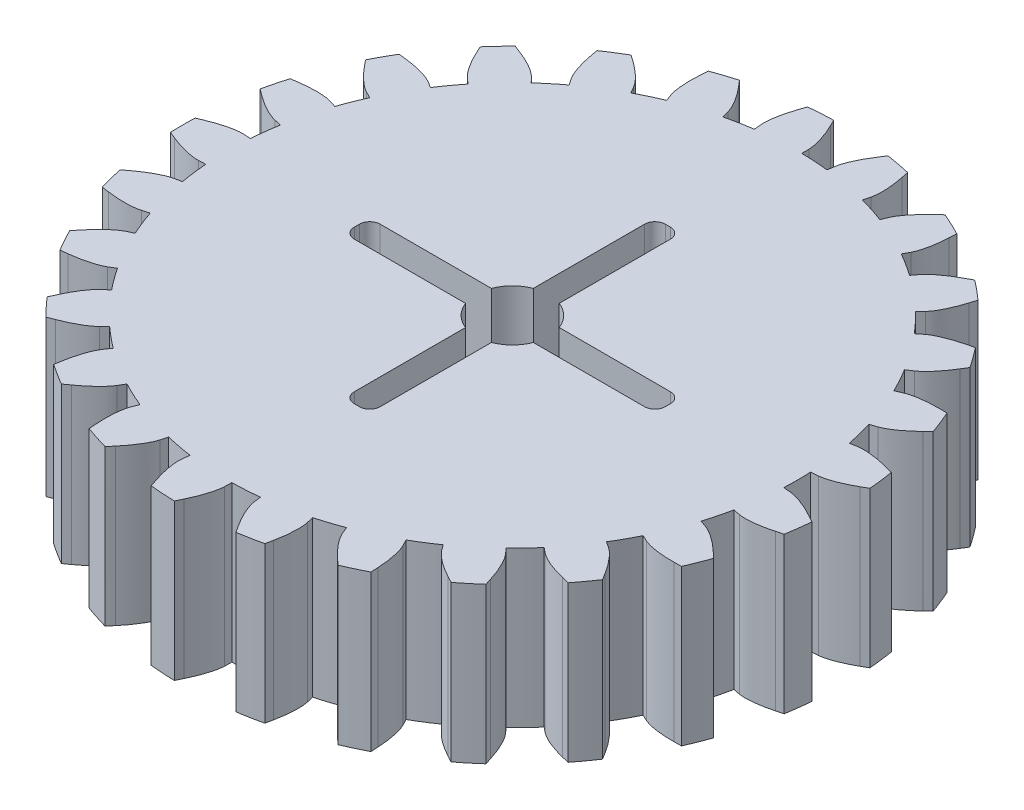
from build123d import *

# Parameters (mm, degrees)
SKETCH5_R           = 27.5
BOSS_EXTRUDE1_DEPTH = 15
BOSS_EXTRUDE2_DEPTH = 15
CIRPATTERN2_COUNT   = 25
CUT_EXTRUDE1_DEPTH  = 48.414177317
FILLET1_R           = 1


with BuildPart() as part:
    # Sketch5 → Boss-Extrude1 (new body)
    with BuildSketch(Plane(origin=(0, 0, 0), x_dir=(1, 0, 0), z_dir=(0, 1, 0))):
        with Locations(Location((0, 0, 0), (0, 0, 270))):
            Circle(SKETCH5_R)
    extrude(amount=BOSS_EXTRUDE1_DEPTH)

    # Sketch7 → Boss-Extrude2 (add)
    with BuildSketch(Plane(origin=(0, 0, 0), x_dir=(1, 0, 0), z_dir=(0, 1, 0))):
        with BuildLine():
            Line((0.419103344, 28.187663113), (0.419103344, 27.496806222))
            ThreePointArc((0.419103344, 27.496806222), (-1.735576403, 27.445177619), (-3.879595269, 27.224965391))
            Line((-3.879595269, 27.224965391), (-3.948649553, 27.912867393))
            add(Edge.make_bspline(
                [(-3.408300207, 30.987456132), (-3.481876172, 30.773678284), (-3.581035388, 30.460011842), (-3.692037809, 30.050014355), (-3.75969093, 29.770412754), (-3.815470726, 29.509231584), (-3.860426563, 29.266893651), (-3.895615791, 29.043778597), (-3.922128058, 28.840221794), (-3.960523355, 28.466443269), (-3.970699746, 28.158767672), (-3.948649553, 27.912867393)],
                knots=[0, 0, 0, 0, 0.215964682, 0.314109795, 0.405696755, 0.490725563, 0.569196219, 0.641108722, 0.706463074, 0.765259273, 1, 1, 1, 1], degree=3))
            add(Edge.make_bspline(
                [(-3.408300207, 30.987456132), (-3.260286585, 31.433974048), (-3.186933306, 31.649953493)],
                knots=[0, 0, 0, 1, 1, 1], degree=2))
            ThreePointArc((-3.186933306, 31.649953493), (-1.997366426, 31.747230231), (-0.804987629, 31.799812813))
            add(Edge.make_bspline(
                [(-0.502333335, 31.17028407), (-0.70514336, 31.594730034), (-0.804987629, 31.799812813)],
                knots=[0, 0, 0, 1, 1, 1], degree=2))
            add(Edge.make_bspline(
                [(-0.502333335, 31.17028407), (-0.40254407, 30.967413438), (-0.264853924, 30.668648295), (-0.103340479, 30.275796053), (-0.001177451, 30.006878378), (0.086897185, 29.754747763), (0.161871529, 29.519955197), (0.22474701, 29.303009852), (0.276562653, 29.104381023), (0.361502062, 28.73836206), (0.410160187, 28.434388017), (0.419103344, 28.187663113)],
                knots=[0, 0, 0, 0, 0.215964682, 0.314109795, 0.405696755, 0.490725563, 0.569196219, 0.641108722, 0.706463074, 0.765259273, 1, 1, 1, 1], degree=3))
        make_face()
    boss_extrude2 = extrude(amount=BOSS_EXTRUDE2_DEPTH)

    # CirPattern2: Boss-Extrude2 ×25 about axis
    cirpattern2_axis = Axis((0, 15, 0), (0, 1, 0))
    for i in range(1, CIRPATTERN2_COUNT):
        add(boss_extrude2.rotate(cirpattern2_axis, i * 360 / CIRPATTERN2_COUNT))

    # Sketch9 → Cut-Extrude1 (cut, through all)
    with BuildSketch(Plane(origin=(0, 15, 0), x_dir=(1, 0, 0), z_dir=(0, 1, 0))):
        with BuildLine():
            Line((1.25, 3.269174208), (1.25, 15))
            Line((1.25, 15), (-1.25, 15))
            Line((-1.25, 15), (-1.25, 3.269174208))
            ThreePointArc((-1.25, 3.269174208), (-2.474873734, 2.474873734), (-3.269174208, 1.25))
            Line((-3.269174208, 1.25), (-15, 1.25))
            Line((-15, 1.25), (-15, -1.25))
            Line((-15, -1.25), (-3.269174208, -1.25))
            ThreePointArc((-3.269174208, -1.25), (-2.474873734, -2.474873734), (-1.25, -3.269174208))
            Line((-1.25, -3.269174208), (-1.25, -15))
            Line((-1.25, -15), (1.25, -15))
            Line((1.25, -15), (1.25, -3.269174208))
            ThreePointArc((1.25, -3.269174208), (2.474873734, -2.474873734), (3.269174208, -1.25))
            Line((3.269174208, -1.25), (15, -1.25))
            Line((15, -1.25), (15, 1.25))
            Line((15, 1.25), (3.269174208, 1.25))
            ThreePointArc((3.269174208, 1.25), (2.474873734, 2.474873734), (1.25, 3.269174208))
        make_face()
    extrude(amount=-CUT_EXTRUDE1_DEPTH, mode=Mode.SUBTRACT)

    # Fillet1
    fillet1_edges = [part.edges().sort_by_distance(p)[0] for p in [
        (-1.25, 7.5, -15),
        (1.25, 7.5, -15),
        (15, 7.5, -1.25),
        (15, 7.5, 1.25),
        (1.25, 7.5, 15),
        (-1.25, 7.5, 15),
        (-15, 7.5, 1.25),
        (-15, 7.5, -1.25),
    ]]
    fillet(fillet1_edges, radius=FILLET1_R)


solid = part.part
